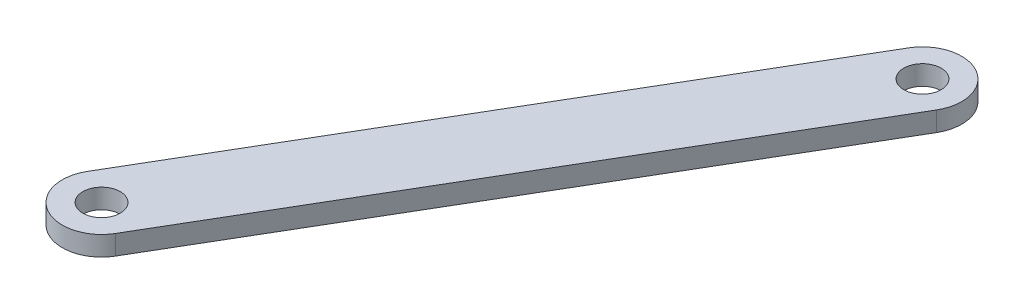
from build123d import *

# Parameters (mm, degrees)
SALIENTE_EXTRUIR1_DEPTH = 15
CROQUIS3_R              = 14.29
CORTAR_EXTRUIR2_DEPTH   = 499.221807184


with BuildPart() as part:
    # Croquis1 → Saliente-Extruir1 (new body)
    with BuildSketch(Plane(origin=(0, 0, 0), x_dir=(1, 0, 0), z_dir=(0, 1, 0))):
        with BuildLine():
            Line((28.62028588, 380.086840422), (-203.253807163, -15.179678662))
            ThreePointArc((-203.253807163, -15.179678662), (-244.309678662, -25.876192837), (-255.006192837, 15.179678662))
            Line((-255.006192837, 15.179678662), (-23.132099794, 410.446197745))
            ThreePointArc((-23.132099794, 410.446197745), (17.923771705, 421.142711921), (28.62028588, 380.086840422))
        make_face()
    extrude(amount=SALIENTE_EXTRUIR1_DEPTH)

    # Croquis3 → Cortar-Extruir2 (cut, through all)
    with BuildSketch(Plane(origin=(0, 15, 0), x_dir=(1, 0, 0), z_dir=(0, 1, 0))):
        with Locations(Location((-229.13, 0, 0), (0, 0, 270))):
            Circle(CROQUIS3_R)
        with Locations(Location((2.744093043, 395.266519084, 0), (0, 0, 270))):
            Circle(CROQUIS3_R)
    extrude(amount=-CORTAR_EXTRUIR2_DEPTH, mode=Mode.SUBTRACT)


solid = part.part
